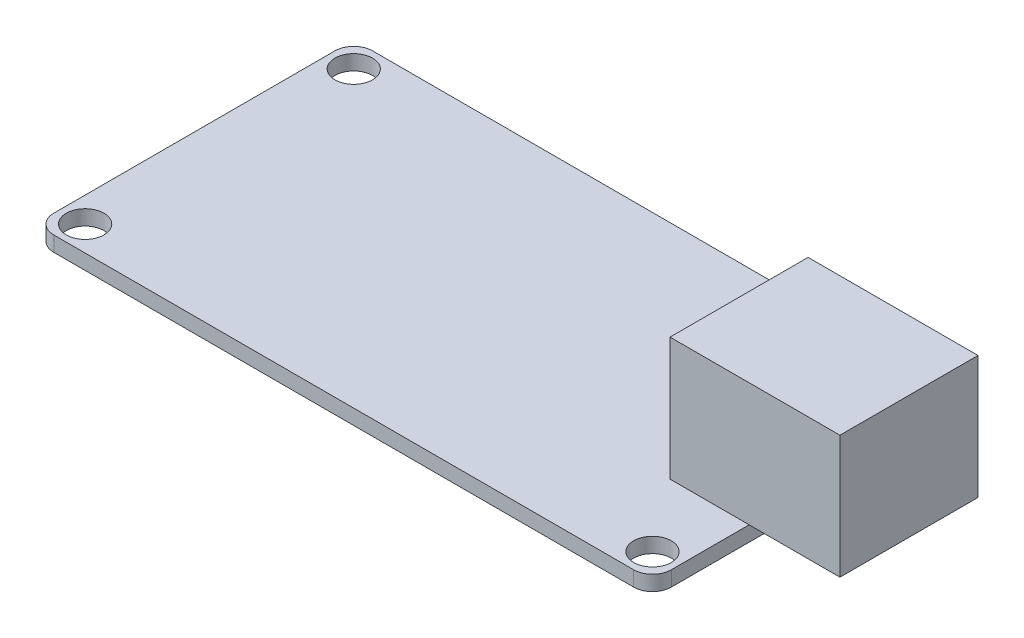
from build123d import *

# Parameters (mm, degrees)
ESQUISSE1_W        = 49.2
ESQUISSE1_H        = 25.4
ESQUISSE1_R        = 1.5
BOSS_EXTRU_1_DEPTH = 1.2
CONG_1_R           = 1.5
CONG_2_R           = 1.5
CONG_3_R           = 1.5
CONG_4_R           = 1.5
ESQUISSE3_W        = 13.534356754
ESQUISSE3_H        = 11
BOSS_EXTRU_2_DEPTH = 9.8


with BuildPart() as part:
    # Esquisse1 → Boss.-Extru.1 (new body)
    with BuildSketch(Plane(origin=(0, 0, 0), x_dir=(1, 0, 0), z_dir=(0, 1, 0))):
        Rectangle(ESQUISSE1_W, ESQUISSE1_H)
        with Locations(Location((22.6, 10.7, 0), (0, 0, 270))):
            Circle(ESQUISSE1_R, mode=Mode.SUBTRACT)
        with Locations(Location((22.6, -10.7, 0), (0, 0, 270))):
            Circle(ESQUISSE1_R, mode=Mode.SUBTRACT)
        with Locations(Location((-22.6, -10.7, 0), (0, 0, 270))):
            Circle(ESQUISSE1_R, mode=Mode.SUBTRACT)
        with Locations(Location((-22.6, 10.7, 0), (0, 0, 270))):
            Circle(ESQUISSE1_R, mode=Mode.SUBTRACT)
    extrude(amount=BOSS_EXTRU_1_DEPTH)

    # Congé1
    cong_1_edges = [part.edges().sort_by_distance(p)[0] for p in [
        (24.6, 0.6, 12.7),
    ]]
    fillet(cong_1_edges, radius=CONG_1_R)

    # Congé2
    cong_2_edges = [part.edges().sort_by_distance(p)[0] for p in [
        (-24.6, 0.6, 12.7),
    ]]
    fillet(cong_2_edges, radius=CONG_2_R)

    # Congé3
    cong_3_edges = [part.edges().sort_by_distance(p)[0] for p in [
        (24.6, 0.6, -12.7),
    ]]
    fillet(cong_3_edges, radius=CONG_3_R)

    # Congé4
    cong_4_edges = [part.edges().sort_by_distance(p)[0] for p in [
        (-24.6, 0.6, -12.7),
    ]]
    fillet(cong_4_edges, radius=CONG_4_R)

    # Esquisse3 → Boss.-Extru.2 (add)
    with BuildSketch(Plane(origin=(1.430842634, 1.2, 0.935550953), x_dir=(1, 0, 0), z_dir=(0, 1, 0))):
        with Locations((23.633586999, 1.436368818)):
            Rectangle(ESQUISSE3_W, ESQUISSE3_H)
    extrude(amount=BOSS_EXTRU_2_DEPTH)


solid = part.part
